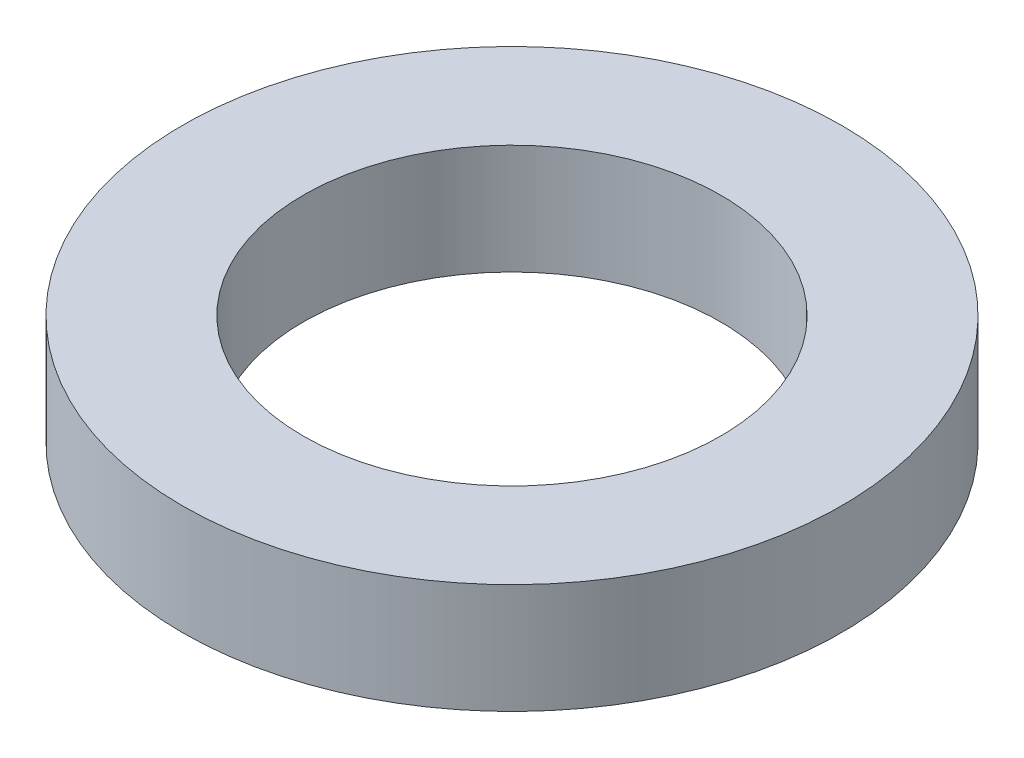
from build123d import *

# Parameters (mm, degrees)
SKETCH1_R           = 3
SKETCH1_R_2         = 1.9
BOSS_EXTRUDE1_DEPTH = 1


with BuildPart() as part:
    # Sketch1 → Boss-Extrude1 (new body)
    with BuildSketch(Plane(origin=(0, 0, 0), x_dir=(1, 0, 0), z_dir=(0, 1, 0))):
        with Locations(Location((0, 0, 0), (0, 0, 270))):
            Circle(SKETCH1_R)
        with Locations(Location((0, 0, 0), (0, 0, 270))):
            Circle(SKETCH1_R_2, mode=Mode.SUBTRACT)
    extrude(amount=BOSS_EXTRUDE1_DEPTH)


solid = part.part
